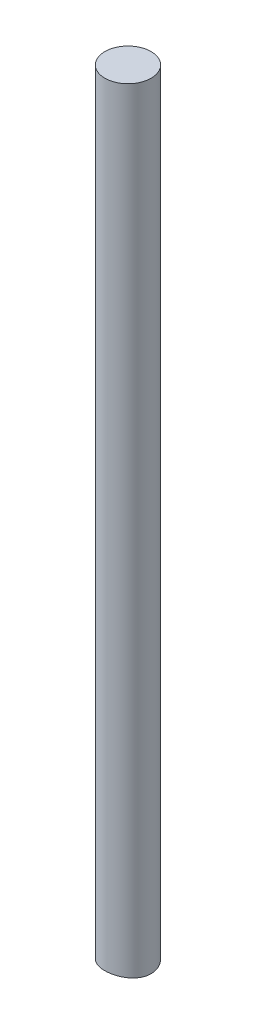
from build123d import *

# Parameters (mm, degrees)
SKETCH2_R               = 9
CUT_EXTRUDE1_DEPTH      = 152.485651136
CUT_EXTRUDE1_DEPTH_BACK = 152.485651136


with BuildPart() as part:
    # Sweep1: sweep along a path in Sketch1
    with BuildLine(Plane.XY) as sweep1_path:
        Line((0, -150.95), (0, 150.95))
    # Sketch2 → Sweep1 (sweep)
    with BuildSketch(Plane(origin=(0, 0, 0), x_dir=(1, 0, 0), z_dir=(0, 1, 0))):
        Circle(SKETCH2_R)
    sweep(path=sweep1_path.line)

    # Sketch3 → Cut-Extrude1 (cut, two sides: drawn at the far end of the back side and taken through both)
    with BuildSketch(Plane.XY.offset(-CUT_EXTRUDE1_DEPTH_BACK)):
        with BuildLine():
            ThreePointArc((9, -150.95), (0, -149.9375), (-9, -150.95))
            Line((-9, -150.95), (0, -150.95))
            Line((0, -150.95), (9, -150.95))
        make_face()
    extrude(amount=CUT_EXTRUDE1_DEPTH + CUT_EXTRUDE1_DEPTH_BACK, mode=Mode.SUBTRACT)


solid = part.part
